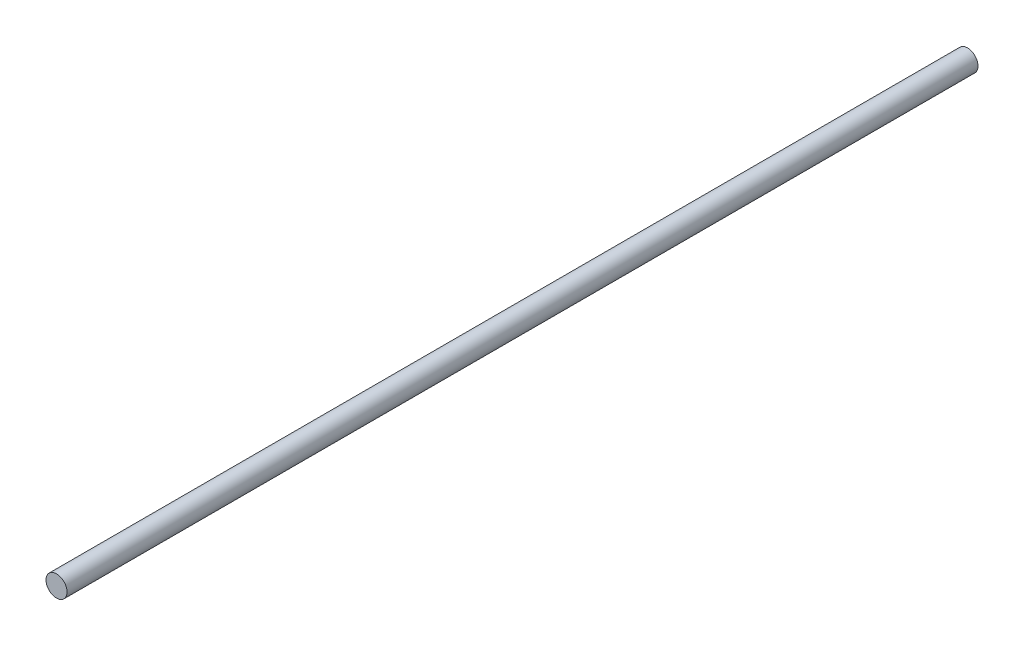
from build123d import *

# Parameters (mm, degrees)
SKETCH1_R           = 2
BOSS_EXTRUDE1_DEPTH = 86.5


with BuildPart() as part:
    # Sketch1 → Boss-Extrude1 (new, symmetric)
    with BuildSketch(Plane.XY):
        Circle(SKETCH1_R)
    extrude(amount=BOSS_EXTRUDE1_DEPTH, both=True)


solid = part.part
